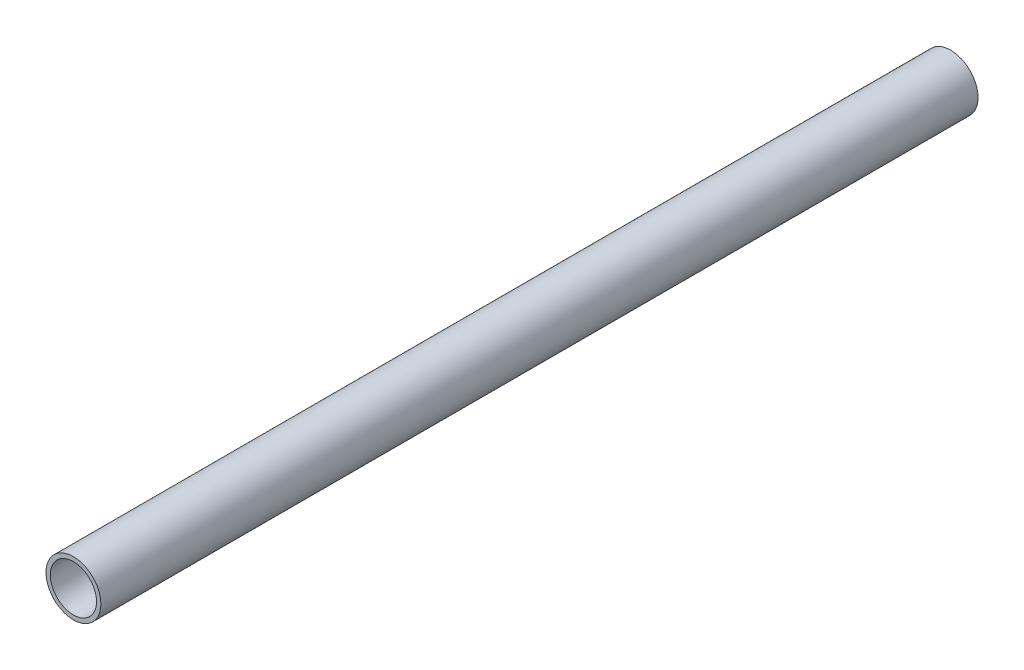
from build123d import *

# Parameters (mm, degrees)
SKETCH1_R           = 4.7625
BOSS_EXTRUDE1_DEPTH = 152.4
SKETCH2_R           = 4.0132
CUT_EXTRUDE1_DEPTH  = 25.4


with BuildPart() as part:
    # Sketch1 → Boss-Extrude1 (new body)
    with BuildSketch(Plane.XY):
        with Locations(Location((0, 0, 0), (0, 0, 180))):
            Circle(SKETCH1_R)
    extrude(amount=BOSS_EXTRUDE1_DEPTH)

    # Sketch2 → Cut-Extrude1 (cut)
    with BuildSketch(Plane.XY.offset(152.4)):
        Circle(SKETCH2_R)
    extrude(amount=-CUT_EXTRUDE1_DEPTH, mode=Mode.SUBTRACT)


solid = part.part
